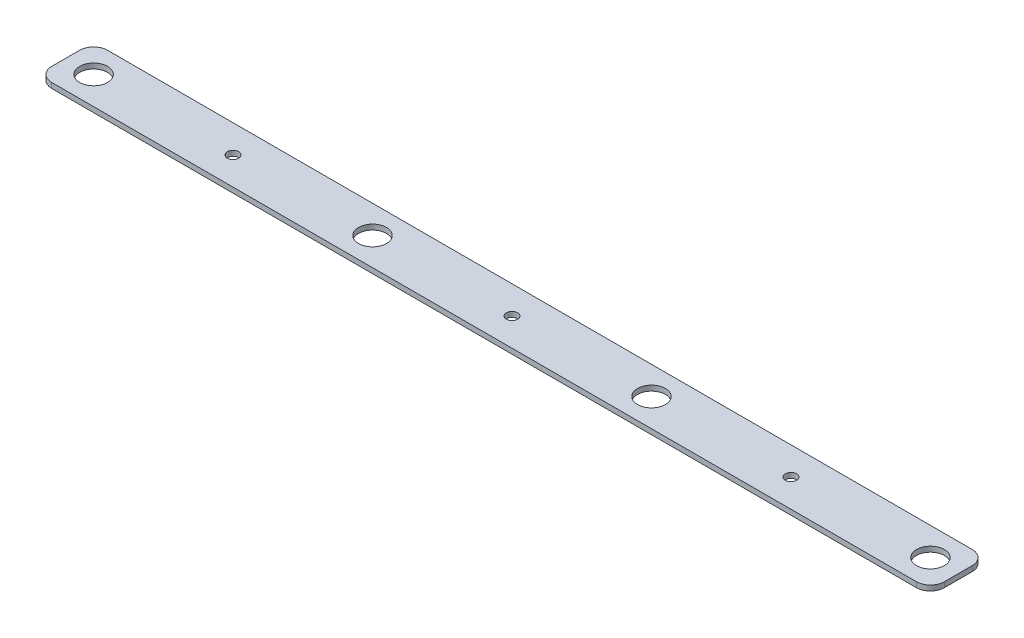
from build123d import *

# Parameters (mm, degrees)
SKETCH1_W           = 406.4
SKETCH1_H           = 25.4
SKETCH1_R           = 6.35
SKETCH1_R_2         = 2.5796875
BOSS_EXTRUDE1_DEPTH = 2.38125
FILLET1_R           = 6.35


with BuildPart() as part:
    # Sketch1 → Boss-Extrude1 (new body)
    with BuildSketch(Plane(origin=(0, 0, 0), x_dir=(1, 0, 0), z_dir=(0, 1, 0))):
        with Locations((203.2, 12.7)):
            Rectangle(SKETCH1_W, SKETCH1_H)
        with Locations(Location((12.7, 12.7, 0), (0, 0, 90))):
            Circle(SKETCH1_R, mode=Mode.SUBTRACT)
        with Locations(Location((393.7, 12.7, 0), (0, 0, 90))):
            Circle(SKETCH1_R, mode=Mode.SUBTRACT)
        with Locations(Location((139.7, 12.7, 0), (0, 0, 90))):
            Circle(SKETCH1_R, mode=Mode.SUBTRACT)
        with Locations(Location((266.7, 12.7, 0), (0, 0, 90))):
            Circle(SKETCH1_R, mode=Mode.SUBTRACT)
        with Locations(Location((76.2, 12.7, 0), (0, 0, 90))):
            Circle(SKETCH1_R_2, mode=Mode.SUBTRACT)
        with Locations(Location((203.2, 12.7, 0), (0, 0, 90))):
            Circle(SKETCH1_R_2, mode=Mode.SUBTRACT)
        with Locations(Location((330.2, 12.7, 0), (0, 0, 90))):
            Circle(SKETCH1_R_2, mode=Mode.SUBTRACT)
    extrude(amount=BOSS_EXTRUDE1_DEPTH)

    # Fillet1
    fillet1_edges = [part.edges().sort_by_distance(p)[0] for p in [
        (0, 1.190625, -25.4),
        (406.4, 1.190625, -25.4),
        (406.4, 1.190625, 0),
        (0, 1.190625, 0),
    ]]
    fillet(fillet1_edges, radius=FILLET1_R)


solid = part.part
